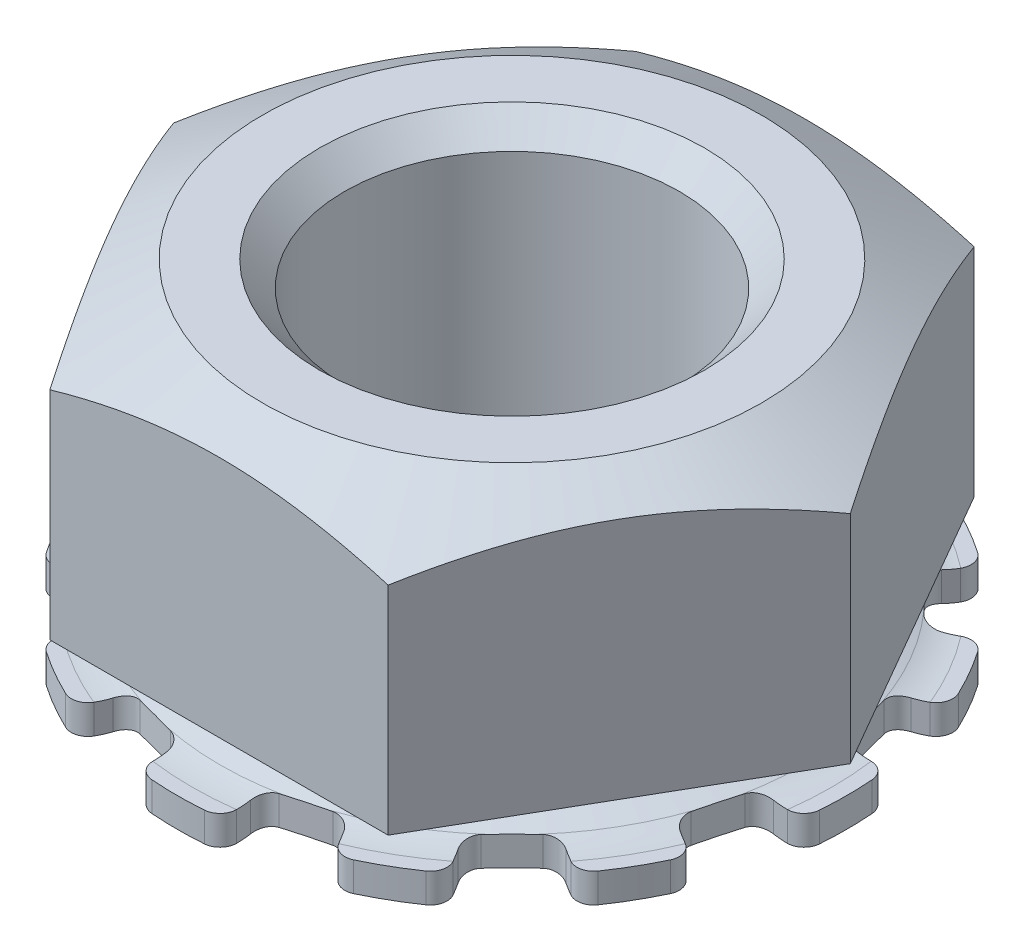
from build123d import *
from build123d.topology import SkipClean

# Parameters (mm, degrees)
EXTRUDE_2_REACH          = 8.499
FILLET_1_R               = 1
CUT_EXTRUDE_1_REACH      = 8.895
PATTERN_CIRCULAR_1_COUNT = 12
FILLET_2_R               = 0.2


with BuildPart() as part:
    # 草图1 → 旋转1 (revolve)
    with BuildSketch(Plane.XY):
        Polygon((2, 3.6), (2, 0), (2.675, 0), (2.675, 0.35), (2.35, 0.35), (2.35, 0.7), (3.5, 0.7), (3.5, 3.6), (2.980384758, 3.9), (2.3, 3.9), align=None)
    revolve(axis=Axis((0, -97.506361361, 0), (0, 1, 0)))

    # 草图1<3> → 旋转2 (revolve)
    with BuildSketch(Plane.XY):
        Polygon((2.35, 0.35), (2.675, 0.35), (3.65, 0), (4, 0), (4, 0.35), (3.65, 0.35), (2.675, 0.7), (2.35, 0.7), align=None)
    revolve(axis=Axis((0, -97.506361361, 0), (0, 1, 0)))

    # 凸台-拉伸2: up to this cone (the profile starts inside it)
    with SkipClean():  # the faces are left unmerged after this step: merging them gives an invalid solid
        extrude_2_end = Plane(origin=(0, 0.7, 0), z_dir=(0, -1, 0)).offset(-4.920724942) * Cone(1.732e-06, 38.871850386, 22.442672284, align=(Align.CENTER, Align.CENTER, Align.MIN), mode=Mode.PRIVATE)
        # 草图2 → 凸台-拉伸2 (add, up to the surface)
        with BuildSketch(Plane(origin=(0, 0.7, 0), x_dir=(1, 0, 0), z_dir=(0, 1, 0)), mode=Mode.PRIVATE) as extrude_2_sk1:
            with BuildLine():
                ThreePointArc((-3.03108888, -1.750000057), (-3.5, -4.1e-08), (-3.031088921, 1.749999986))
                Line((-3.031088921, 1.749999986), (-4.041451884, 0))
                Line((-4.041451884, 0), (-3.03108888, -1.750000057))
            make_face()
        extrude_2_tool1 = extrude(extrude_2_sk1.sketch, amount=EXTRUDE_2_REACH, mode=Mode.PRIVATE) & extrude_2_end
        add(extrude_2_tool1.solids().sort_by_distance((-3.617471, 0.7, 0))[0])
        # 草图2 → 凸台-拉伸2 (add, up to the surface)
        with BuildSketch(Plane(origin=(0, 0.7, 0), x_dir=(1, 0, 0), z_dir=(0, 1, 0)), mode=Mode.PRIVATE) as extrude_2_sk2:
            with BuildLine():
                Line((-2.020725942, -3.5), (0, -3.5))
                ThreePointArc((0, -3.5), (-1.749999971, -3.03108893), (-3.03108888, -1.750000057))
                Line((-3.03108888, -1.750000057), (-2.020725942, -3.5))
            make_face()
        extrude_2_tool2 = extrude(extrude_2_sk2.sketch, amount=EXTRUDE_2_REACH, mode=Mode.PRIVATE) & extrude_2_end
        add(extrude_2_tool2.solids().sort_by_distance((-1.808735, 0.7, 3.132821))[0])
        # 草图2 → 凸台-拉伸2 (add, up to the surface)
        with BuildSketch(Plane(origin=(0, 0.7, 0), x_dir=(1, 0, 0), z_dir=(0, 1, 0)), mode=Mode.PRIVATE) as extrude_2_sk3:
            with BuildLine():
                Line((2.020725942, -3.5), (3.03108887, -1.750000074))
                ThreePointArc((3.03108887, -1.750000074), (1.749999963, -3.031088935), (0, -3.5))
                Line((0, -3.5), (2.020725942, -3.5))
            make_face()
        extrude_2_tool3 = extrude(extrude_2_sk3.sketch, amount=EXTRUDE_2_REACH, mode=Mode.PRIVATE) & extrude_2_end
        add(extrude_2_tool3.solids().sort_by_distance((1.808735, 0.7, 3.132821))[0])
        # 草图2 → 凸台-拉伸2 (add, up to the surface)
        with BuildSketch(Plane(origin=(0, 0.7, 0), x_dir=(1, 0, 0), z_dir=(0, 1, 0)), mode=Mode.PRIVATE) as extrude_2_sk4:
            with BuildLine():
                Line((3.03108887, -1.750000074), (4.041451884, 0))
                Line((4.041451884, 0), (3.03108896, 1.749999919))
                ThreePointArc((3.03108896, 1.749999919), (3.380740404, 0.905866612), (3.5, 0))
                ThreePointArc((3.5, 0), (3.380740381, -0.905866699), (3.03108887, -1.750000074))
            make_face()
        extrude_2_tool4 = extrude(extrude_2_sk4.sketch, amount=EXTRUDE_2_REACH, mode=Mode.PRIVATE) & extrude_2_end
        add(extrude_2_tool4.solids().sort_by_distance((3.617471, 0.7, 0))[0])
        # 草图2 → 凸台-拉伸2 (add, up to the surface)
        with BuildSketch(Plane(origin=(0, 0.7, 0), x_dir=(1, 0, 0), z_dir=(0, 1, 0)), mode=Mode.PRIVATE) as extrude_2_sk5:
            with BuildLine():
                ThreePointArc((7e-09, 3.5), (1.750000044, 3.031088888), (3.03108896, 1.749999919))
                Line((3.03108896, 1.749999919), (2.020725942, 3.5))
                Line((2.020725942, 3.5), (7e-09, 3.5))
            make_face()
        extrude_2_tool5 = extrude(extrude_2_sk5.sketch, amount=EXTRUDE_2_REACH, mode=Mode.PRIVATE) & extrude_2_end
        add(extrude_2_tool5.solids().sort_by_distance((1.808735, 0.7, -3.132821))[0])
        # 草图2 → 凸台-拉伸2 (add, up to the surface)
        with BuildSketch(Plane(origin=(0, 0.7, 0), x_dir=(1, 0, 0), z_dir=(0, 1, 0)), mode=Mode.PRIVATE) as extrude_2_sk6:
            with BuildLine():
                ThreePointArc((-3.031088921, 1.749999986), (-1.750000004, 3.031088911), (7e-09, 3.5))
                Line((7e-09, 3.5), (-2.020725942, 3.5))
                Line((-2.020725942, 3.5), (-3.031088921, 1.749999986))
            make_face()
        extrude_2_tool6 = extrude(extrude_2_sk6.sketch, amount=EXTRUDE_2_REACH, mode=Mode.PRIVATE) & extrude_2_end
        add(extrude_2_tool6.solids().sort_by_distance((-1.808735, 0.7, -3.132821))[0])

    # 圆角1
    fillet_1_edges = [part.edges().sort_by_distance(p)[0] for p in [
        (-3.65, 0, 0),
        (-3.65, 0.35, 0),
    ]]
    fillet(fillet_1_edges, radius=FILLET_1_R)

    # 草图3 → 切除-拉伸1 (cut, up to next)
    with BuildSketch(Plane(origin=(0, 0, 0), x_dir=(1, 0, 0), z_dir=(0, 1, 0)), mode=Mode.PRIVATE) as cut_extrude_1_sk1:
        with BuildLine():
            Line((-0.5, 3.968626967), (-0.5, 3.468626967))
            Line((-0.5, 3.468626967), (-0.900650391, 3.361273018))
            Line((-0.900650391, 3.361273018), (-1.03527618, 3.863703305))
            ThreePointArc((-1.03527618, 3.863703305), (-0.769428672, 3.925299927), (-0.5, 3.968626967))
        make_face()
    cut_extrude_1_tool1 = extrude(cut_extrude_1_sk1.sketch, amount=CUT_EXTRUDE_1_REACH, mode=Mode.PRIVATE) & part.part
    # 草图3 → 切除-拉伸1 (cut, up to next)
    with BuildSketch(Plane(origin=(0, 0, 0), x_dir=(1, 0, 0), z_dir=(0, 1, 0)), mode=Mode.PRIVATE) as cut_extrude_1_sk2:
        with BuildLine():
            Line((0.5, 3.468626967), (0.5, 3.968626967))
            ThreePointArc((0.5, 3.968626967), (0.769428672, 3.925299927), (1.03527618, 3.863703305))
            Line((1.03527618, 3.863703305), (0.900650391, 3.361273018))
            Line((0.900650391, 3.361273018), (0.5, 3.468626967))
        make_face()
    cut_extrude_1_tool2 = extrude(cut_extrude_1_sk2.sketch, amount=CUT_EXTRUDE_1_REACH, mode=Mode.PRIVATE) & part.part
    cut_extrude_1_1 = cut_extrude_1_tool1.solids().sort_by_distance((-0.738452, 0, -3.679985))[0]
    add(cut_extrude_1_1, mode=Mode.SUBTRACT)
    cut_extrude_1_2 = cut_extrude_1_tool2.solids().sort_by_distance((0.738452, 0, -3.679985))[0]
    add(cut_extrude_1_2, mode=Mode.SUBTRACT)
    cut_extrude_1 = cut_extrude_1_1 + cut_extrude_1_2  # 切除-拉伸1 as one shape, for the pattern or mirror that repeats it

    # 阵列(圆周)1: 切除-拉伸1 ×12 about axis
    with SkipClean():  # the faces are left unmerged after this step: merging them gives an invalid solid
        pattern_circular_1_axis = Axis((0, 0, 0), (0, 1, 0))
        for i in range(1, PATTERN_CIRCULAR_1_COUNT):
            add(cut_extrude_1.rotate(pattern_circular_1_axis, i * 360 / PATTERN_CIRCULAR_1_COUNT), mode=Mode.SUBTRACT)

    # 圆角2
    fillet_2_edges = [part.edges().sort_by_distance(p)[0] for p in [
        (-0.5, 0.227437637, -3.468626967),
        (-0.5, 0.175, -3.968626967),
        (0.5, 0.227437637, -3.468626967),
        (0.5, 0.175, -3.968626967),
        (2.167326185, 0.227437637, 2.753919069),
        (2.753919069, 0.227437637, 2.167326185),
        (2.417326185, 0.175, 3.186931771),
        (3.186931771, 0.175, 2.417326185),
        (0.5, 0.227437637, 3.468626967),
        (1.301300781, 0.227437637, 3.253919069),
        (0.5, 0.175, 3.968626967),
        (1.551300781, 0.175, 3.686931771),
        (3.468626967, 0.227437637, -0.5),
        (3.253919069, 0.227437637, -1.301300781),
        (3.968626967, 0.175, -0.5),
        (3.686931771, 0.175, -1.551300781),
        (3.253919069, 0.227437637, 1.301300781),
        (3.468626967, 0.227437637, 0.5),
        (3.686931771, 0.175, 1.551300781),
        (3.968626967, 0.175, 0.5),
        (-3.468626967, 0.227437637, 0.5),
        (-3.253919069, 0.227437637, 1.301300781),
        (-3.968626967, 0.175, 0.5),
        (-3.686931771, 0.175, 1.551300781),
        (-3.253919069, 0.227437637, -1.301300781),
        (-3.468626967, 0.227437637, -0.5),
        (-3.686931771, 0.175, -1.551300781),
        (-3.968626967, 0.175, -0.5),
        (-1.301300781, 0.227437637, -3.253919069),
        (-1.551300781, 0.175, -3.686931771),
        (-1.301300781, 0.227437637, 3.253919069),
        (-0.5, 0.227437637, 3.468626967),
        (-1.551300781, 0.175, 3.686931771),
        (-0.5, 0.175, 3.968626967),
        (-2.753919069, 0.227437637, 2.167326185),
        (-2.167326185, 0.227437637, 2.753919069),
        (-3.186931771, 0.175, 2.417326185),
        (-2.417326185, 0.175, 3.186931771),
        (2.753919069, 0.227437637, -2.167326185),
        (2.167326185, 0.227437637, -2.753919069),
        (3.186931771, 0.175, -2.417326185),
        (2.417326185, 0.175, -3.186931771),
        (1.301300781, 0.227437637, -3.253919069),
        (1.551300781, 0.175, -3.686931771),
        (-2.167326185, 0.227437637, -2.753919069),
        (-2.753919069, 0.227437637, -2.167326185),
        (-2.417326185, 0.175, -3.186931771),
        (-3.186931771, 0.175, -2.417326185),
    ]]
    fillet(fillet_2_edges, radius=FILLET_2_R)


solid = part.part
